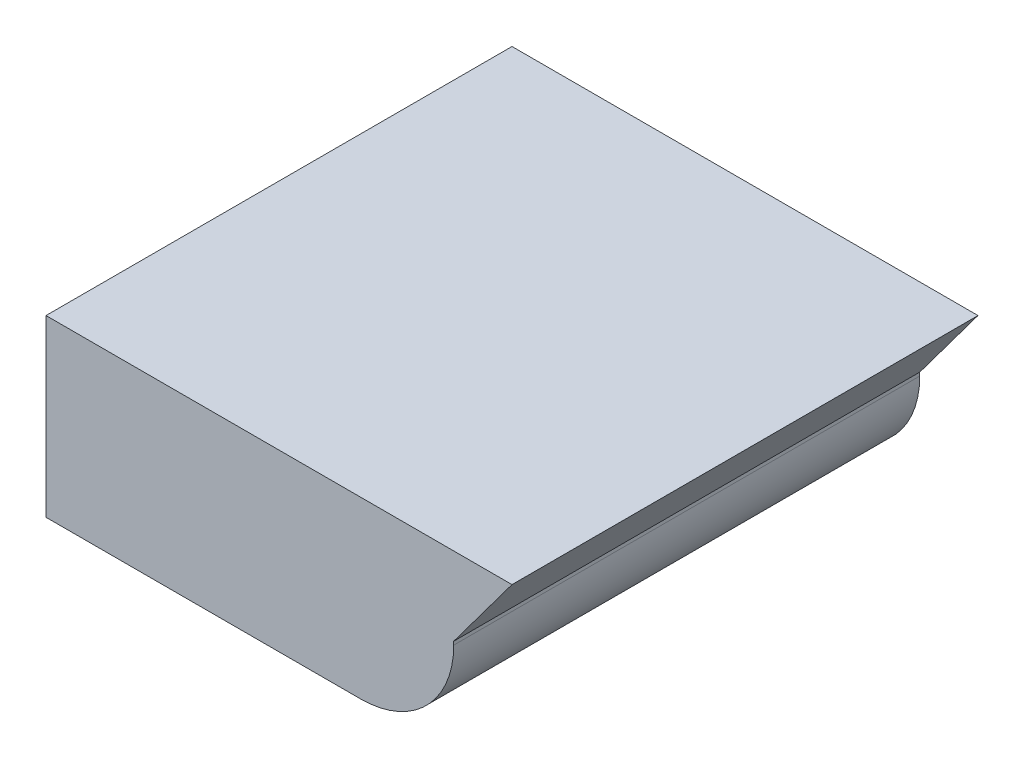
from build123d import *

# Parameters (mm, degrees)
BOSS_EXTRUDE1_DEPTH = 40
FILLET1_R           = 8


with BuildPart() as part:
    # Sketch1 → Boss-Extrude1 (new body)
    with BuildSketch(Plane.XY):
        Polygon((-13.768148554, -75.866074504), (26.231851446, -75.866074504), (21.231851446, -82.575243148), (21.231851446, -90.866074504), (-13.768148554, -90.866074504), align=None)
    extrude(amount=BOSS_EXTRUDE1_DEPTH)

    # Fillet1
    fillet1_edges = [part.edges().sort_by_distance(p)[0] for p in [
        (21.231851446, -90.866074504, 20),
    ]]
    fillet(fillet1_edges, radius=FILLET1_R)


solid = part.part
